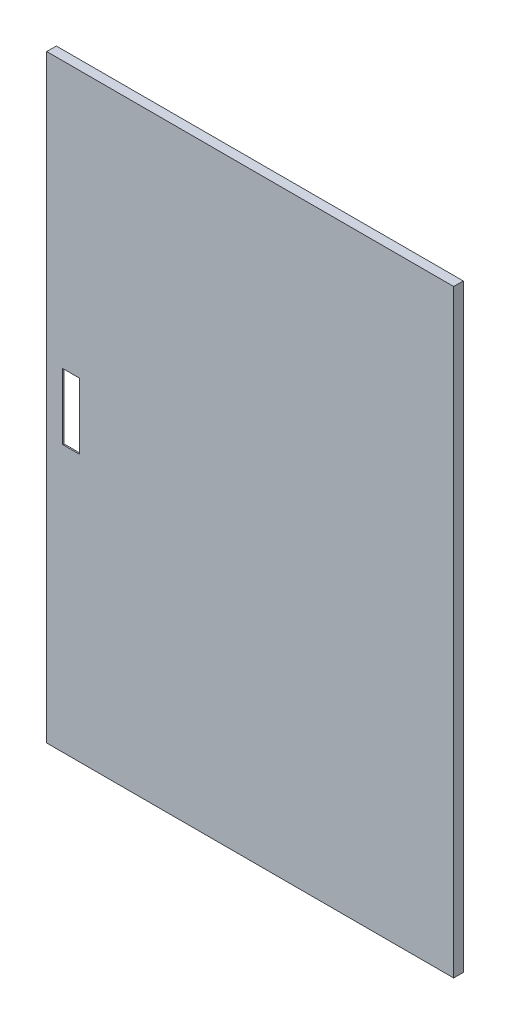
from build123d import *

# Parameters (mm, degrees)
SKETCH_1_W          = 636
SKETCH_1_H          = 936
EXTRUDE_1_DEPTH     = 2
SKETCH_2_W          = 636
SKETCH_2_H          = 936
SKETCH_2_W_2        = 632
SKETCH_2_H_2        = 932
EXTRUDE_2_DEPTH     = 11
SKETCH_3_W          = 636
SKETCH_3_H          = 936
SKETCH_3_W_2        = 616
SKETCH_3_H_2        = 916
EXTRUDE_3_DEPTH     = 2
SKETCH_4_W          = 26
SKETCH_4_H          = 103
CUT_EXTRUDE_1_DEPTH = 10


with BuildPart() as part:
    # 草图1 → 凸台-拉伸1 (new body)
    with BuildSketch(Plane.XY):
        Rectangle(SKETCH_1_W, SKETCH_1_H)
    extrude(amount=EXTRUDE_1_DEPTH)

    # 草图2 → 凸台-拉伸2 (add)
    with BuildSketch(Plane(origin=(0, 0, 0), x_dir=(-1, 0, 0), z_dir=(0, 0, -1))):
        Rectangle(SKETCH_2_W, SKETCH_2_H)
        Rectangle(SKETCH_2_W_2, SKETCH_2_H_2, mode=Mode.SUBTRACT)
    extrude(amount=EXTRUDE_2_DEPTH)

    # 草图3 → 凸台-拉伸3 (add)
    with BuildSketch(Plane(origin=(0, 0, -11), x_dir=(-1, 0, 0), z_dir=(0, 0, -1))):
        Rectangle(SKETCH_3_W, SKETCH_3_H)
        Rectangle(SKETCH_3_W_2, SKETCH_3_H_2, mode=Mode.SUBTRACT)
    extrude(amount=EXTRUDE_3_DEPTH)

    # 草图4 → 切除-拉伸1 (cut)
    with BuildSketch(Plane.XY.offset(2)):
        with Locations((-280, 0)):
            Rectangle(SKETCH_4_W, SKETCH_4_H)
    extrude(amount=-CUT_EXTRUDE_1_DEPTH, mode=Mode.SUBTRACT)


solid = part.part
